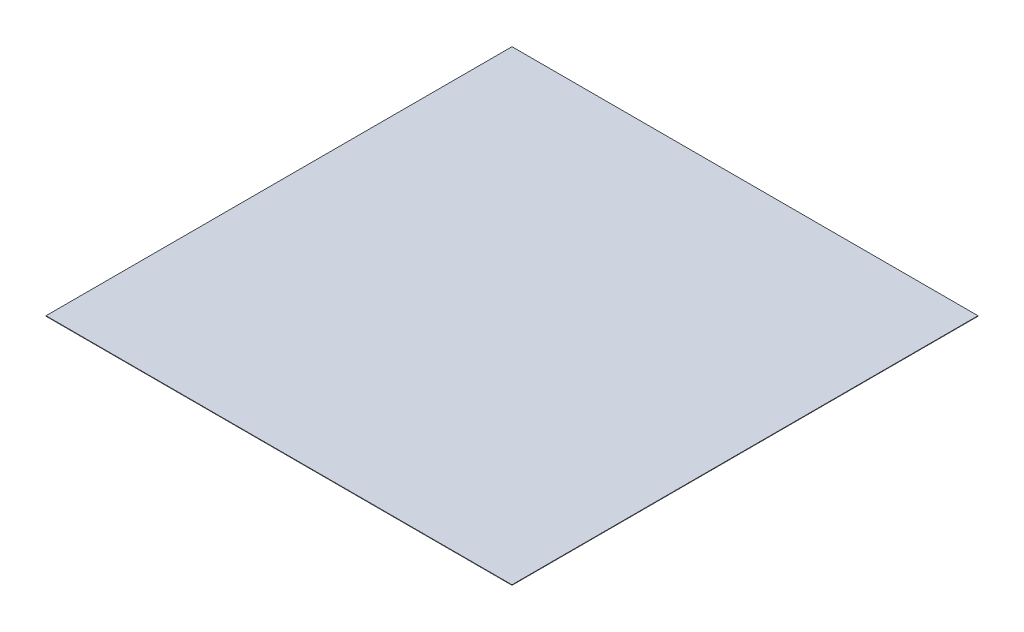
from build123d import *

# Parameters (mm, degrees)
SKETCH1_W           = 2540
SKETCH1_H           = 2540
BOSS_EXTRUDE1_DEPTH = 2.54


with BuildPart() as part:
    # Sketch1 → Boss-Extrude1 (new body)
    with BuildSketch(Plane(origin=(0, 0, 0), x_dir=(1, 0, 0), z_dir=(0, 1, 0))):
        with Locations((-763.765932793, 0)):
            Rectangle(SKETCH1_W, SKETCH1_H)
    extrude(amount=BOSS_EXTRUDE1_DEPTH)


solid = part.part
